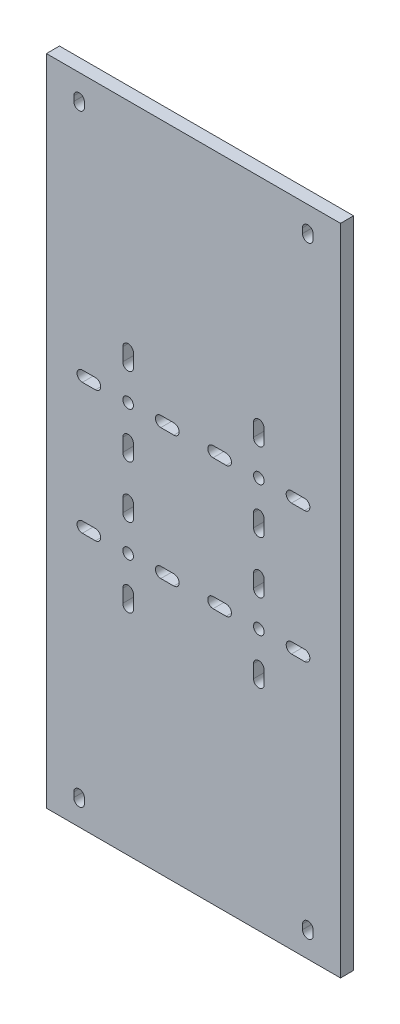
from build123d import *

# Parameters (mm, degrees)
SKETCH_1_W      = 180
SKETCH_1_H      = 384
SKETCH_1_R      = 3.25
EXTRUDE_1_DEPTH = 8
SKETCH_2_W      = 180
SKETCH_2_H      = 8
EXTRUDE_2_DEPTH = 8
SKETCH_3_W      = 180
SKETCH_3_H      = 8
EXTRUDE_3_DEPTH = 8


with BuildPart() as part:
    # 草图1 → 凸台-拉伸1 (new body)
    with BuildSketch(Plane.XY):
        with Locations((0, 177)):
            Rectangle(SKETCH_1_W, SKETCH_1_H)
        with Locations((40, 217)):
            Circle(SKETCH_1_R, mode=Mode.SUBTRACT)
        with Locations(Location((-40, 217, 0), (0, 0, 180))):
            Circle(SKETCH_1_R, mode=Mode.SUBTRACT)
        with Locations(Location((40, 137, 0), (0, 0, 180))):
            Circle(SKETCH_1_R, mode=Mode.SUBTRACT)
        with Locations((-40, 137)):
            Circle(SKETCH_1_R, mode=Mode.SUBTRACT)
        with BuildLine():
            Line((-73.25, 360), (-73.25, 363))
            ThreePointArc((-73.25, 363), (-70, 366.25), (-66.75, 363))
            Line((-66.75, 363), (-66.75, 360))
            ThreePointArc((-66.75, 360), (-70, 356.75), (-73.25, 360))
        make_face(mode=Mode.SUBTRACT)
        with BuildLine():
            Line((73.25, 360), (73.25, 363))
            ThreePointArc((73.25, 363), (70, 366.25), (66.75, 363))
            Line((66.75, 363), (66.75, 360))
            ThreePointArc((66.75, 360), (70, 356.75), (73.25, 360))
        make_face(mode=Mode.SUBTRACT)
        with BuildLine():
            Line((-73.25, -6), (-73.25, -9))
            ThreePointArc((-73.25, -9), (-70, -12.25), (-66.75, -9))
            Line((-66.75, -9), (-66.75, -6))
            ThreePointArc((-66.75, -6), (-70, -2.75), (-73.25, -6))
        make_face(mode=Mode.SUBTRACT)
        with BuildLine():
            Line((73.25, -6), (73.25, -9))
            ThreePointArc((73.25, -9), (70, -12.25), (66.75, -9))
            Line((66.75, -9), (66.75, -6))
            ThreePointArc((66.75, -6), (70, -2.75), (73.25, -6))
        make_face(mode=Mode.SUBTRACT)
        with BuildLine():
            Line((12, 220.25), (20, 220.25))
            ThreePointArc((20, 220.25), (23.25, 217), (20, 213.75))
            Line((20, 213.75), (12, 213.75))
            ThreePointArc((12, 213.75), (8.75, 217), (12, 220.25))
        make_face(mode=Mode.SUBTRACT)
        with BuildLine():
            Line((43.25, 245), (43.25, 237))
            ThreePointArc((43.25, 237), (40, 233.75), (36.75, 237))
            Line((36.75, 237), (36.75, 245))
            ThreePointArc((36.75, 245), (40, 248.25), (43.25, 245))
        make_face(mode=Mode.SUBTRACT)
        with BuildLine():
            Line((-43.25, 245), (-43.25, 237))
            ThreePointArc((-43.25, 237), (-40, 233.75), (-36.75, 237))
            Line((-36.75, 237), (-36.75, 245))
            ThreePointArc((-36.75, 245), (-40, 248.25), (-43.25, 245))
        make_face(mode=Mode.SUBTRACT)
        with BuildLine():
            Line((-12, 220.25), (-20, 220.25))
            ThreePointArc((-20, 220.25), (-23.25, 217), (-20, 213.75))
            Line((-20, 213.75), (-12, 213.75))
            ThreePointArc((-12, 213.75), (-8.75, 217), (-12, 220.25))
        make_face(mode=Mode.SUBTRACT)
        with BuildLine():
            Line((-36.75, 189), (-36.75, 197))
            ThreePointArc((-36.75, 197), (-40, 200.25), (-43.25, 197))
            Line((-43.25, 197), (-43.25, 189))
            ThreePointArc((-43.25, 189), (-40, 185.75), (-36.75, 189))
        make_face(mode=Mode.SUBTRACT)
        with BuildLine():
            Line((-68, 213.75), (-60, 213.75))
            ThreePointArc((-60, 213.75), (-56.75, 217), (-60, 220.25))
            Line((-60, 220.25), (-68, 220.25))
            ThreePointArc((-68, 220.25), (-71.25, 217), (-68, 213.75))
        make_face(mode=Mode.SUBTRACT)
        with BuildLine():
            Line((68, 213.75), (60, 213.75))
            ThreePointArc((60, 213.75), (56.75, 217), (60, 220.25))
            Line((60, 220.25), (68, 220.25))
            ThreePointArc((68, 220.25), (71.25, 217), (68, 213.75))
        make_face(mode=Mode.SUBTRACT)
        with BuildLine():
            Line((36.75, 189), (36.75, 197))
            ThreePointArc((36.75, 197), (40, 200.25), (43.25, 197))
            Line((43.25, 197), (43.25, 189))
            ThreePointArc((43.25, 189), (40, 185.75), (36.75, 189))
        make_face(mode=Mode.SUBTRACT)
        with BuildLine():
            Line((-68, 140.25), (-60, 140.25))
            ThreePointArc((-60, 140.25), (-56.75, 137), (-60, 133.75))
            Line((-60, 133.75), (-68, 133.75))
            ThreePointArc((-68, 133.75), (-71.25, 137), (-68, 140.25))
        make_face(mode=Mode.SUBTRACT)
        with BuildLine():
            Line((-43.25, 109), (-43.25, 117))
            ThreePointArc((-43.25, 117), (-40, 120.25), (-36.75, 117))
            Line((-36.75, 117), (-36.75, 109))
            ThreePointArc((-36.75, 109), (-40, 105.75), (-43.25, 109))
        make_face(mode=Mode.SUBTRACT)
        with BuildLine():
            Line((-12, 133.75), (-20, 133.75))
            ThreePointArc((-20, 133.75), (-23.25, 137), (-20, 140.25))
            Line((-20, 140.25), (-12, 140.25))
            ThreePointArc((-12, 140.25), (-8.75, 137), (-12, 133.75))
        make_face(mode=Mode.SUBTRACT)
        with BuildLine():
            Line((-36.75, 165), (-36.75, 157))
            ThreePointArc((-36.75, 157), (-40, 153.75), (-43.25, 157))
            Line((-43.25, 157), (-43.25, 165))
            ThreePointArc((-43.25, 165), (-40, 168.25), (-36.75, 165))
        make_face(mode=Mode.SUBTRACT)
        with BuildLine():
            Line((43.25, 109), (43.25, 117))
            ThreePointArc((43.25, 117), (40, 120.25), (36.75, 117))
            Line((36.75, 117), (36.75, 109))
            ThreePointArc((36.75, 109), (40, 105.75), (43.25, 109))
        make_face(mode=Mode.SUBTRACT)
        with BuildLine():
            Line((12, 133.75), (20, 133.75))
            ThreePointArc((20, 133.75), (23.25, 137), (20, 140.25))
            Line((20, 140.25), (12, 140.25))
            ThreePointArc((12, 140.25), (8.75, 137), (12, 133.75))
        make_face(mode=Mode.SUBTRACT)
        with BuildLine():
            Line((68, 140.25), (60, 140.25))
            ThreePointArc((60, 140.25), (56.75, 137), (60, 133.75))
            Line((60, 133.75), (68, 133.75))
            ThreePointArc((68, 133.75), (71.25, 137), (68, 140.25))
        make_face(mode=Mode.SUBTRACT)
        with BuildLine():
            Line((36.75, 165), (36.75, 157))
            ThreePointArc((36.75, 157), (40, 153.75), (43.25, 157))
            Line((43.25, 157), (43.25, 165))
            ThreePointArc((43.25, 165), (40, 168.25), (36.75, 165))
        make_face(mode=Mode.SUBTRACT)
    extrude(amount=EXTRUDE_1_DEPTH)

    # 草图2 → 凸台-拉伸2 (add)
    with BuildSketch(Plane(origin=(0, 369, 0), x_dir=(1, 0, 0), z_dir=(0, 1, 0))):
        with Locations((0, -4)):
            Rectangle(SKETCH_2_W, SKETCH_2_H)
    extrude(amount=EXTRUDE_2_DEPTH)

    # 草图3 → 凸台-拉伸3 (add)
    with BuildSketch(Plane.XZ.offset(15)):
        with Locations((0, 4)):
            Rectangle(SKETCH_3_W, SKETCH_3_H)
    extrude(amount=EXTRUDE_3_DEPTH)


solid = part.part
